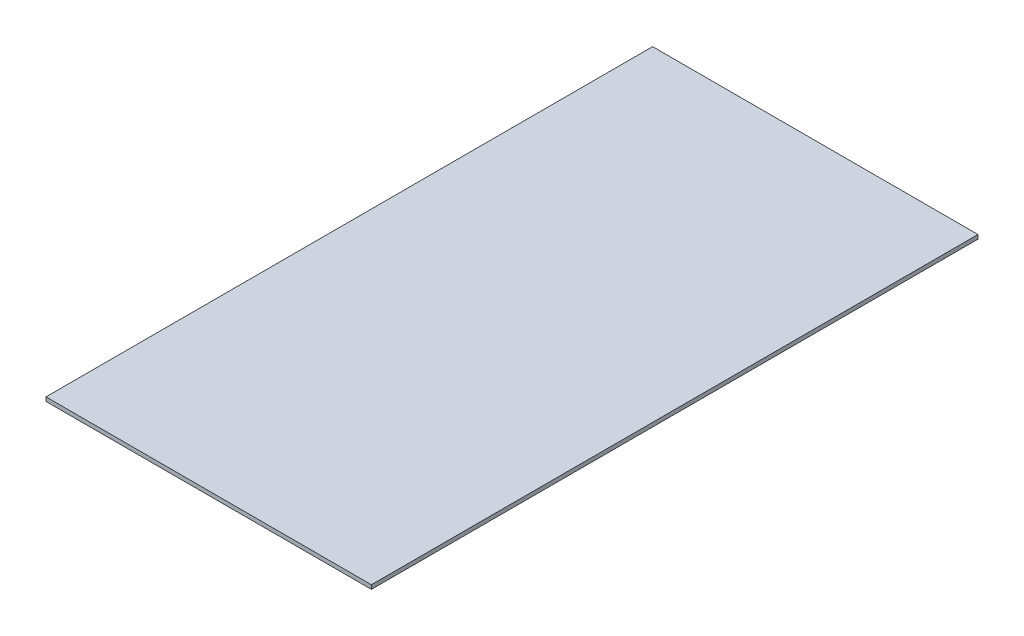
from build123d import *

# Parameters (mm, degrees)
SKETCH1_W           = 1028.7
SKETCH1_H           = 1917.7
BOSS_EXTRUDE1_DEPTH = 12.7


with BuildPart() as part:
    # Sketch1 → Boss-Extrude1 (new body)
    with BuildSketch(Plane(origin=(0, 0, 0), x_dir=(1, 0, 0), z_dir=(0, 1, 0))):
        with Locations((514.35, 958.85)):
            Rectangle(SKETCH1_W, SKETCH1_H)
    extrude(amount=BOSS_EXTRUDE1_DEPTH)


solid = part.part
